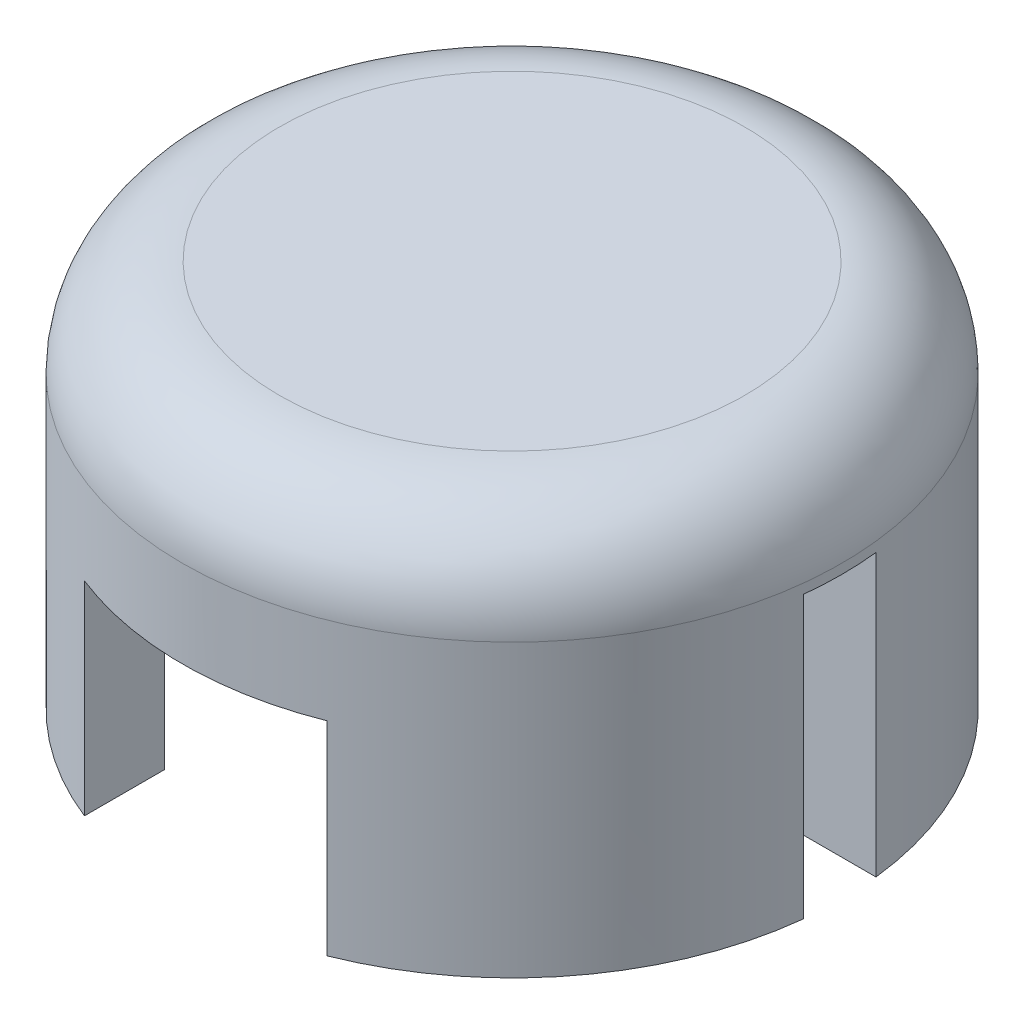
from build123d import *

# Parameters (mm, degrees)
SKETCH1_R               = 6.8
SKETCH1_R_2             = 5.3
BOSS_EXTRUDE1_DEPTH     = 5.8
SKETCH2_R               = 6.8
BOSS_EXTRUDE2_DEPTH     = 2.2
FILLET1_R               = 2
SKETCH4_W               = 5
SKETCH4_H               = 4.2
CUT_EXTRUDE1_DEPTH      = 13.509196726
CUT_EXTRUDE2_DEPTH      = 13.509196726
CUT_EXTRUDE2_DEPTH_BACK = 13.509196726
SKETCH5_W               = 1.5
SKETCH5_H               = 5.8
SKETCH3_R               = 3
BOSS_EXTRUDE3_DEPTH     = 2.5


with BuildPart() as part:
    # Sketch1 → Boss-Extrude1 (new body)
    with BuildSketch(Plane(origin=(0, 0, 0), x_dir=(1, 0, 0), z_dir=(0, 1, 0))):
        with Locations(Location((0, 0, 0), (0, 0, 270))):
            Circle(SKETCH1_R)
        with Locations(Location((0, 0, 0), (0, 0, 270))):
            Circle(SKETCH1_R_2, mode=Mode.SUBTRACT)
    extrude(amount=BOSS_EXTRUDE1_DEPTH)

    # Sketch2 → Boss-Extrude2 (add)
    with BuildSketch(Plane(origin=(0, 5.8, 0), x_dir=(1, 0, 0), z_dir=(0, 1, 0))):
        with Locations(Location((0, 0, 0), (0, 0, 270))):
            Circle(SKETCH2_R)
    extrude(amount=BOSS_EXTRUDE2_DEPTH)

    # Fillet1
    fillet1_edges = [part.edges().sort_by_distance(p)[0] for p in [
        (0, 8, -6.8),
    ]]
    fillet(fillet1_edges, radius=FILLET1_R)

    # Sketch4 → Cut-Extrude1 (cut, through all)
    with BuildSketch(Plane.XY):
        with Locations((0, 2.1)):
            Rectangle(SKETCH4_W, SKETCH4_H)
    extrude(amount=CUT_EXTRUDE1_DEPTH, mode=Mode.SUBTRACT)

    # Sketch5 → Cut-Extrude2 (cut, two sides: drawn at the far end of the back side and taken through both)
    with BuildSketch(Plane(origin=(0, 0, 0), x_dir=(0, 0, -1), z_dir=(1, 0, 0)).offset(-CUT_EXTRUDE2_DEPTH_BACK)):
        with Locations((0, 2.9)):
            Rectangle(SKETCH5_W, SKETCH5_H)
    extrude(amount=CUT_EXTRUDE2_DEPTH + CUT_EXTRUDE2_DEPTH_BACK, mode=Mode.SUBTRACT)

    # Sketch3 → Boss-Extrude3 (add)
    with BuildSketch(Plane.XZ.offset(-5.8)):
        with Locations(Location((0, 0, 0), (0, 0, 90))):
            Circle(SKETCH3_R)
    extrude(amount=BOSS_EXTRUDE3_DEPTH)


solid = part.part
